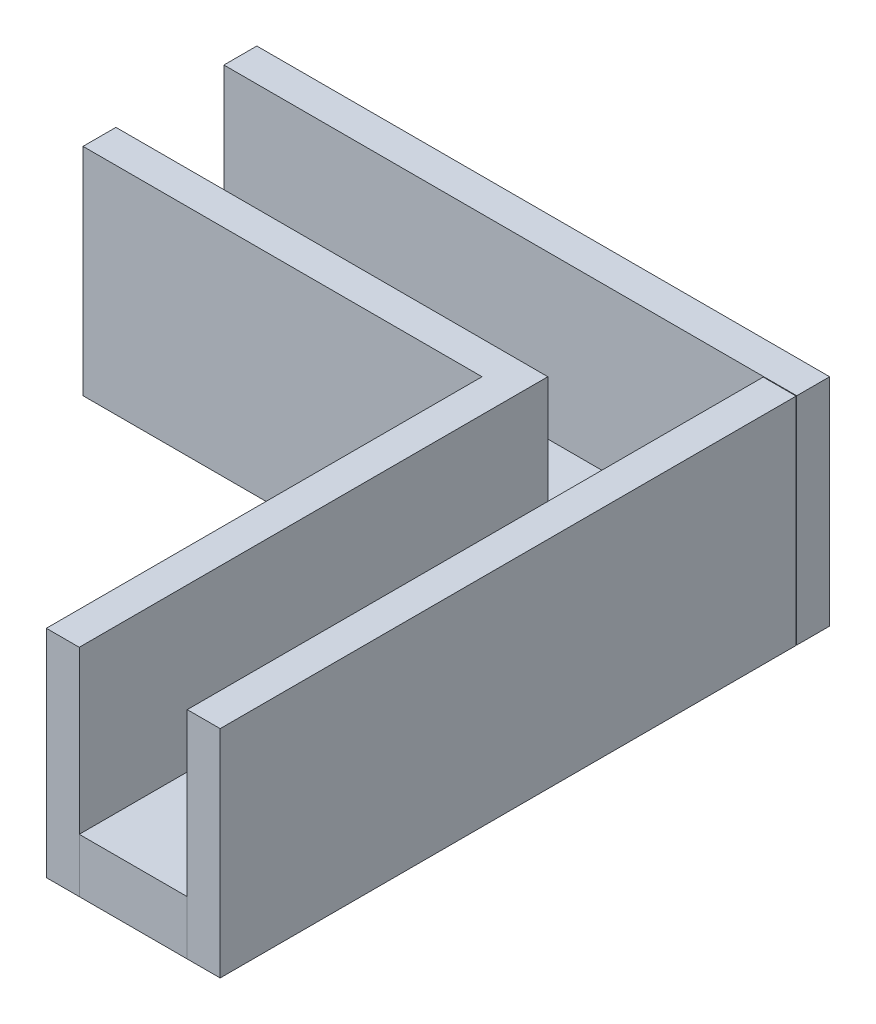
from build123d import *

# Parameters (mm, degrees)
BOSS_EXTRUDE3_DEPTH = 2.5
SKETCH1_11_W        = 1.524
SKETCH1_11_H        = 26.67
SKETCH1_11_H_2      = 20.174000038
SKETCH1_11_W_2      = 26.524
SKETCH1_11_H_3      = 1.524
BOSS_EXTRUDE4_DEPTH = 10


with BuildPart() as part:
    # Sketch1 → Boss-Extrude3 (new body)
    with BuildSketch(Plane(origin=(0, 0, 0), x_dir=(1, 0, 0), z_dir=(0, 1, 0))):
        Polygon((12.5, -24.198000038), (12.5, 2.5), (-12.5, 2.5), (-12.5, -2.5), (7.500000094, -2.5), (7.500000094, -24.198000038), align=None)
    extrude(amount=BOSS_EXTRUDE3_DEPTH)


with BuildPart() as body_2:
    # Sketch1<11> → Boss-Extrude4 (new body)
    with BuildSketch(Plane(origin=(0, 0, 0), x_dir=(1, 0, 0), z_dir=(0, 1, 0))):
        with Locations((13.262, -10.863000038)):
            Rectangle(SKETCH1_11_W, SKETCH1_11_H)
        Polygon((7.500000094, -4.024), (7.500000094, -2.5), (-12.5, -2.5), (-12.5, -4.024), (5.976000094, -4.024), align=None)
        with Locations((6.738000094, -14.111000019)):
            Rectangle(SKETCH1_11_W, SKETCH1_11_H_2)
        with Locations((0.762, 3.262)):
            Rectangle(SKETCH1_11_W_2, SKETCH1_11_H_3)
    extrude(amount=BOSS_EXTRUDE4_DEPTH)


solid = Compound([part.part, body_2.part])
